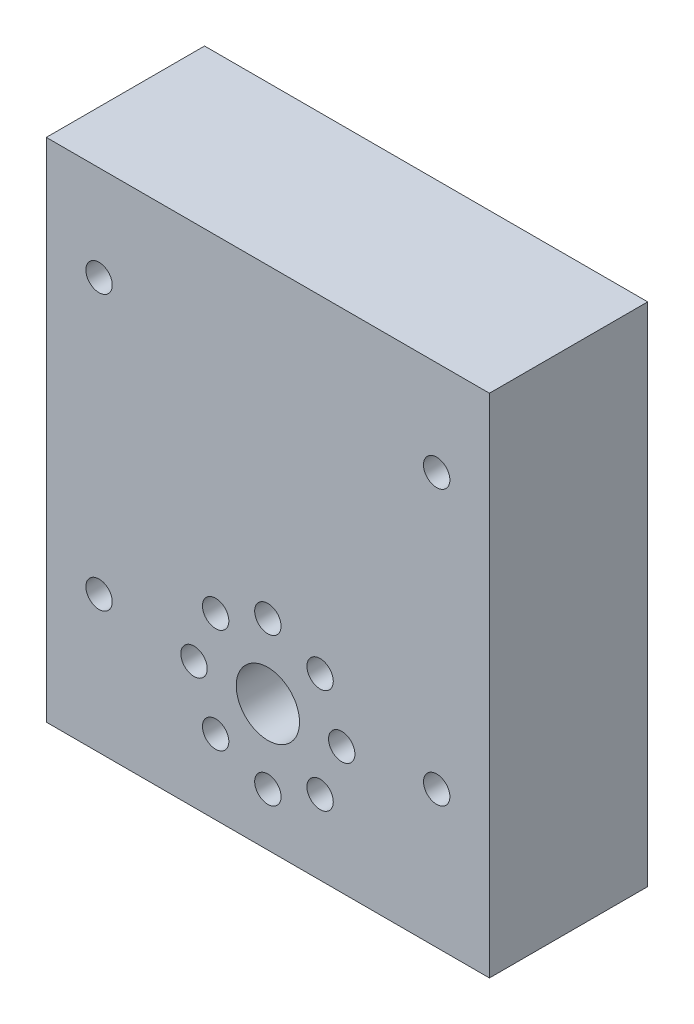
from build123d import *

# Parameters (mm, degrees)
SKETCH_1_W          = 42
SKETCH_1_H          = 48
SKETCH_1_R          = 1.25
EXTRUDE_1_DEPTH     = 15
SKETCH_2_R          = 3
SKETCH_2_R_2        = 1.25
CUT_EXTRUDE_1_DEPTH = 20


with BuildPart() as part:
    # 草圖1 → 填料-伸長1 (new body)
    with BuildSketch(Plane.XY):
        with Locations((-20.813738939, -9.020397992)):
            Rectangle(SKETCH_1_W, SKETCH_1_H)
        with Locations((-36.813738939, 5.979602008)):
            Circle(SKETCH_1_R, mode=Mode.SUBTRACT)
        with Locations((-36.813738939, -20.020397992)):
            Circle(SKETCH_1_R, mode=Mode.SUBTRACT)
        with Locations((-4.813738939, -20.020397992)):
            Circle(SKETCH_1_R, mode=Mode.SUBTRACT)
        with Locations((-4.813738939, 5.979602008)):
            Circle(SKETCH_1_R, mode=Mode.SUBTRACT)
    extrude(amount=EXTRUDE_1_DEPTH)

    # 草圖2 → 除料-伸長1 (cut)
    with BuildSketch(Plane.XY.offset(15)):
        with Locations((-20.813738939, -21.020397992)):
            Circle(SKETCH_2_R)
        with Locations((-20.813738939, -14.020397992)):
            Circle(SKETCH_2_R_2)
        with Locations((-25.763486407, -16.070650524)):
            Circle(SKETCH_2_R_2)
        with Locations((-27.813738939, -21.020397992)):
            Circle(SKETCH_2_R_2)
        with Locations((-25.763486407, -25.970145461)):
            Circle(SKETCH_2_R_2)
        with Locations((-20.813738939, -28.020397992)):
            Circle(SKETCH_2_R_2)
        with Locations((-15.86399147, -25.970145461)):
            Circle(SKETCH_2_R_2)
        with Locations((-13.813738939, -21.020397992)):
            Circle(SKETCH_2_R_2)
        with Locations((-15.86399147, -16.070650524)):
            Circle(SKETCH_2_R_2)
    extrude(amount=-CUT_EXTRUDE_1_DEPTH, mode=Mode.SUBTRACT)


solid = part.part
